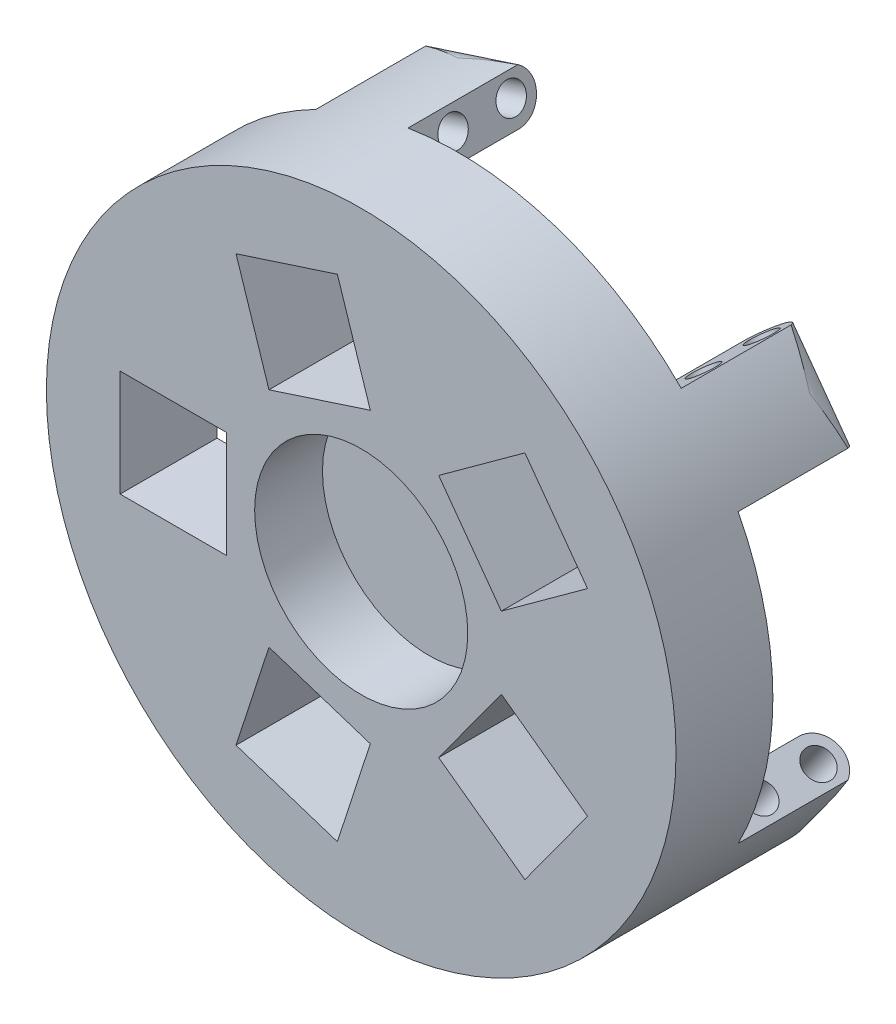
from build123d import *
from build123d.topology import SkipClean

# Parameters (mm, degrees)
ESQUISSE1_R                  = 32.5
BOSS_EXTRU_1_DEPTH           = 10
ESQUISSE2_R                  = 1.5
BOSS_EXTRU_2_DEPTH           = 5
ENL_V_MAT_EXTRU_1_DEPTH      = 48.631397208
R_P_TITION_CIRCULAIRE1_COUNT = 5
ENL_V_MAT_EXTRU_3_DEPTH      = 48.631397303
R_P_TITION_CIRCULAIRE2_COUNT = 5
ESQUISSE5_R                  = 11
ENL_V_MAT_EXTRU_4_DEPTH      = 7


with BuildPart() as part:
    # Esquisse1 → Boss.-Extru.1 (new body)
    with BuildSketch(Plane.XY):
        Circle(ESQUISSE1_R)
    extrude(amount=BOSS_EXTRU_1_DEPTH)

    # Esquisse2 → Boss.-Extru.2 (add, symmetric)
    with BuildSketch(Plane(origin=(0, 0, 0), x_dir=(1, 0, 0), z_dir=(0, 1, 0))):
        with BuildLine():
            Line((-32.5, 0), (-32.5, 10))
            ThreePointArc((-32.5, 10), (-30, 12.5), (-27.5, 10))
            Line((-27.5, 10), (-27.5, 0))
            Line((-27.5, 0), (-32.5, 0))
        make_face()
        with Locations((-30, 10)):
            Circle(ESQUISSE2_R, mode=Mode.SUBTRACT)
        with Locations((-30, 4)):
            Circle(ESQUISSE2_R, mode=Mode.SUBTRACT)
    boss_extru_2 = extrude(amount=BOSS_EXTRU_2_DEPTH, both=True)

    # Esquisse3 → Enlèv. mat.-Extru.1 (cut, through all)
    with SkipClean():  # the faces are left unmerged after this step: merging them gives an invalid solid
        with BuildSketch(Plane.XY):
            with BuildLine():
                ThreePointArc((-32.5, 0), (-32.403125984, 2.507474126), (-32.113081447, 5))
                Line((-32.113081447, 5), (-32.5, 5))
                Line((-32.5, 5), (-32.5, 0))
            make_face()
            with BuildLine():
                ThreePointArc((-32.113081447, -5), (-32.403125984, -2.507474126), (-32.5, 0))
                Line((-32.5, 0), (-32.5, -5))
                Line((-32.5, -5), (-32.113081447, -5))
            make_face()
        enl_v_mat_extru_1 = extrude(amount=-ENL_V_MAT_EXTRU_1_DEPTH, mode=Mode.SUBTRACT)

    # Répétition circulaire1: Boss.-Extru.2, Enlèv. mat.-Extru.1 ×5 about axis
    with SkipClean():  # the faces are left unmerged after this step: merging them gives an invalid solid
        r_p_tition_circulaire1_axis = Axis((0, 0, 0), (0, 0, 1))
        add([boss_extru_2.rotate(r_p_tition_circulaire1_axis, i * 360 / R_P_TITION_CIRCULAIRE1_COUNT) for i in range(1, R_P_TITION_CIRCULAIRE1_COUNT)])
        add([enl_v_mat_extru_1.rotate(r_p_tition_circulaire1_axis, i * 360 / R_P_TITION_CIRCULAIRE1_COUNT) for i in range(1, R_P_TITION_CIRCULAIRE1_COUNT)], mode=Mode.SUBTRACT)

    # Esquisse4 → Enlèv. mat.-Extru.3 (cut, through all)
    with SkipClean():  # the faces are left unmerged after this step: merging them gives an invalid solid
        with BuildSketch(Plane(origin=(0, 0, 0), x_dir=(-1, 0, 0), z_dir=(0, 0, -1))):
            Polygon((18.761540723, 5.5), (13.886540723, 5.5), (13.886540723, -5.5), (18.761540723, -5.5), (24.011540723, -5.5), (24.886540723, -5.5), (24.886540723, 5.5), (24.011540723, 5.5), align=None)
        enl_v_mat_extru_3 = extrude(amount=-ENL_V_MAT_EXTRU_3_DEPTH, mode=Mode.SUBTRACT)

    # Répétition circulaire2: Enlèv. mat.-Extru.3 ×5 about axis
    with SkipClean():  # the faces are left unmerged after this step: merging them gives an invalid solid
        r_p_tition_circulaire2_axis = Axis((0, 0, 0), (0, 0, 1))
        for i in range(1, R_P_TITION_CIRCULAIRE2_COUNT):
            add(enl_v_mat_extru_3.rotate(r_p_tition_circulaire2_axis, i * 360 / R_P_TITION_CIRCULAIRE2_COUNT), mode=Mode.SUBTRACT)

    # Esquisse5 → Enlèv. mat.-Extru.4 (cut)
    with SkipClean():  # the faces are left unmerged after this step: merging them gives an invalid solid
        with BuildSketch(Plane.XY.offset(10)):
            Circle(ESQUISSE5_R)
        extrude(amount=-ENL_V_MAT_EXTRU_4_DEPTH, mode=Mode.SUBTRACT)


solid = part.part
